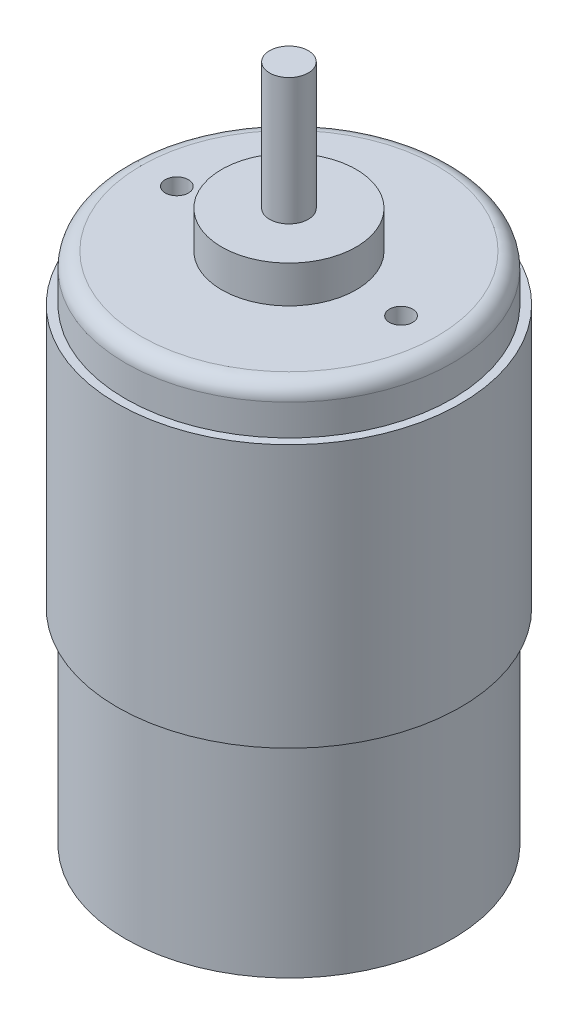
from build123d import *

# Parameters (mm, degrees)
SKETCH1_R           = 21.125
BOSS_EXTRUDE1_DEPTH = 66.5
SKETCH2_R           = 7.2
BOSS_EXTRUDE2_DEPTH = 4
SKETCH3_R           = 2.5
BOSS_EXTRUDE3_DEPTH = 6.2
SKETCH4_R           = 8.7
BOSS_EXTRUDE4_DEPTH = 4.8
BOSS_EXTRUDE5_START = 16.4
SKETCH5_R           = 2.5
BOSS_EXTRUDE5_DEPTH = 16.4
SKETCH6_R           = 1.5
CUT_EXTRUDE1_DEPTH  = 5
BOSS_EXTRUDE6_START = -40
BOSS_EXTRUDE6_DEPTH = 40
CUT_EXTRUDE2_START  = -6
CUT_EXTRUDE2_DEPTH  = 6
FILLET1_R           = 2


with BuildPart() as part:
    # Sketch1 → Boss-Extrude1 (new body)
    with BuildSketch(Plane(origin=(0, 0, 0), x_dir=(1, 0, 0), z_dir=(0, 1, 0))):
        with Locations(Location((0, 0, 0), (0, 0, 270))):
            Circle(SKETCH1_R)
    extrude(amount=BOSS_EXTRUDE1_DEPTH)

    # Sketch2 → Boss-Extrude2 (add)
    with BuildSketch(Plane.XZ):
        with Locations(Location((0, 0, 0), (0, 0, 270))):
            Circle(SKETCH2_R)
    extrude(amount=BOSS_EXTRUDE2_DEPTH)

    # Sketch3 → Boss-Extrude3 (add)
    with BuildSketch(Plane.XZ.offset(4)):
        with Locations(Location((0, 0, 0), (0, 0, 90))):
            Circle(SKETCH3_R)
    extrude(amount=BOSS_EXTRUDE3_DEPTH)

    # Sketch4 → Boss-Extrude4 (add)
    with BuildSketch(Plane(origin=(0, 66.5, 0), x_dir=(1, 0, 0), z_dir=(0, 1, 0))):
        with Locations(Location((0, 0, 0), (0, 0, 270))):
            Circle(SKETCH4_R)
    extrude(amount=BOSS_EXTRUDE4_DEPTH)

    # Sketch5 → Boss-Extrude5 (add)
    with BuildSketch(Plane(origin=(0, 71.3, 0), x_dir=(1, 0, 0), z_dir=(0, 1, 0)).offset(BOSS_EXTRUDE5_START)):
        with Locations(Location((0, 0, 0), (0, 0, 270))):
            Circle(SKETCH5_R)
    extrude(amount=-BOSS_EXTRUDE5_DEPTH)

    # Sketch6 → Cut-Extrude1 (cut)
    with BuildSketch(Plane(origin=(0, 66.5, 0), x_dir=(1, 0, 0), z_dir=(0, 1, 0))):
        with Locations(Location((14.5, 0, 0), (0, 0, 270))):
            Circle(SKETCH6_R)
        with Locations(Location((-14.5, 0, 0), (0, 0, 270))):
            Circle(SKETCH6_R)
    extrude(amount=-CUT_EXTRUDE1_DEPTH, mode=Mode.SUBTRACT)

    # Sketch7 → Boss-Extrude6 (add)
    with BuildSketch(Plane(origin=(0, 66.5, 0), x_dir=(1, 0, 0), z_dir=(0, 1, 0)).offset(BOSS_EXTRUDE6_START)):
        with BuildLine():
            Line((1.25, 21.087985323), (1.25, 22.164780622))
            ThreePointArc((1.25, 22.164780622), (0, -22.2), (-1.25, 22.164780622))
            Line((-1.25, 22.164780622), (-1.25, 21.087985323))
            ThreePointArc((-1.25, 21.087985323), (0, -21.125), (1.25, 21.087985323))
        make_face()
    extrude(amount=BOSS_EXTRUDE6_DEPTH)

    # Sketch7<3> → Cut-Extrude2 (cut)
    with BuildSketch(Plane(origin=(0, 66.5, 0), x_dir=(1, 0, 0), z_dir=(0, 1, 0)).offset(CUT_EXTRUDE2_START)):
        with BuildLine():
            Line((1.25, 21.087985323), (1.25, 22.164780622))
            ThreePointArc((1.25, 22.164780622), (0, -22.2), (-1.25, 22.164780622))
            Line((-1.25, 22.164780622), (-1.25, 21.087985323))
            ThreePointArc((-1.25, 21.087985323), (0, -21.125), (1.25, 21.087985323))
        make_face()
    extrude(amount=CUT_EXTRUDE2_DEPTH, mode=Mode.SUBTRACT)

    # Fillet1
    fillet1_edges = [part.edges().sort_by_distance(p)[0] for p in [
        (1.25, 66.5, 21.087985323),
    ]]
    fillet(fillet1_edges, radius=FILLET1_R)


solid = part.part
